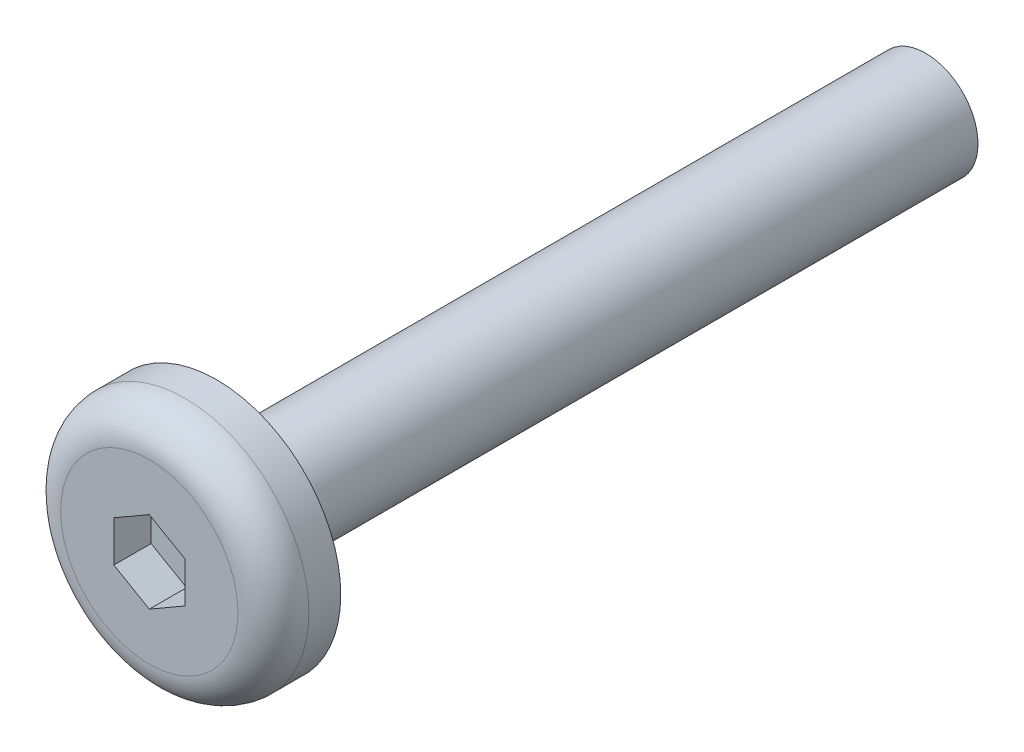
from build123d import *

# Parameters (mm, degrees)
FILLET1_R          = 1
CUT_EXTRUDE1_DEPTH = 1.05


with BuildPart() as part:
    # Sketch1 → Revolve1 (revolve)
    with BuildSketch(Plane(origin=(0, 0, 0), x_dir=(0, 0, -1), z_dir=(1, 0, 0)), mode=Mode.PRIVATE) as revolve1_sk:
        Polygon((1.9, 1.475), (1.9, 3.5), (0, 3.5), (0, 0), (21.9, 0), (21.9, 1.475), align=None)
    revolve(revolve1_sk.sketch.rotate(Axis((0, 0, 0), (0, 0, -1)), 90), axis=Axis((0, 0, 0), (0, 0, -1)))

    # Fillet1
    fillet1_edges = [part.edges().sort_by_distance(p)[0] for p in [
        (-3.5, 0, 0),
    ]]
    fillet(fillet1_edges, radius=FILLET1_R)

    # Sketch2 → Cut-Extrude1 (cut)
    with BuildSketch(Plane.XY):
        Polygon((0, 1.154700538), (-1, 0.577350269), (-1, -0.577350269), (0, -1.154700538), (1, -0.577350269), (1, 0.577350269), align=None)
    extrude(amount=-CUT_EXTRUDE1_DEPTH, mode=Mode.SUBTRACT)


solid = part.part
